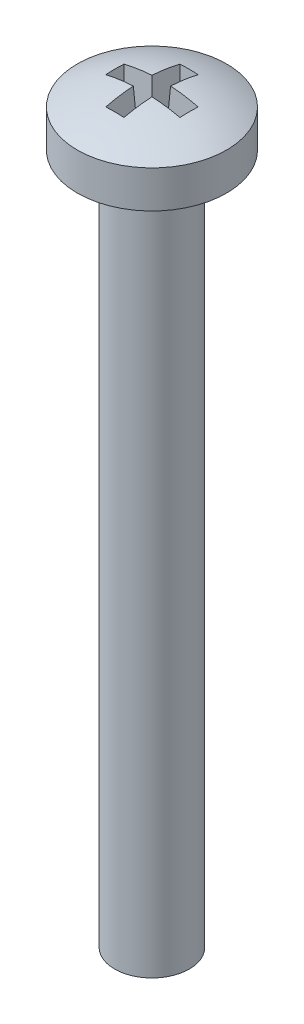
from build123d import *

# Parameters (mm, degrees)
SKETCH1_R           = 2
BOSS_EXTRUDE1_DEPTH = 37
SKETCH2_R           = 4
BOSS_EXTRUDE2_DEPTH = 2
DOME1_FACE_RADIUS   = 4
DOME1_HEIGHT        = 1
CUT_EXTRUDE1_DEPTH  = 3
CUT_EXTRUDE1_TAPER  = 3


with BuildPart() as part:
    # Sketch1 → Boss-Extrude1 (new body)
    with BuildSketch(Plane(origin=(0, 0, 0), x_dir=(1, 0, 0), z_dir=(0, 1, 0))):
        with Locations(Location((0, 0, 0), (0, 0, 270))):
            Circle(SKETCH1_R)
    extrude(amount=BOSS_EXTRUDE1_DEPTH)

    # Sketch2 → Boss-Extrude2 (add)
    with BuildSketch(Plane(origin=(0, 37, 0), x_dir=(1, 0, 0), z_dir=(0, 1, 0))):
        with Locations(Location((0, 0, 0), (0, 0, 270))):
            Circle(SKETCH2_R)
    extrude(amount=BOSS_EXTRUDE2_DEPTH)

    # Dome1: a dome of height H over a round flat face of radius A is a cap of a sphere of radius (A * A + H * H) / (2 * H)
    dome1_r = (DOME1_FACE_RADIUS * DOME1_FACE_RADIUS + DOME1_HEIGHT * DOME1_HEIGHT) / (2 * DOME1_HEIGHT)
    dome1_base = Plane((0, 39, 0), z_dir=(0, 1, 0))
    with Locations(dome1_base.offset(DOME1_HEIGHT - dome1_r)):
        dome1_ball = Sphere(dome1_r, mode=Mode.PRIVATE)
    add(split(dome1_ball, bisect_by=dome1_base, keep=Keep.TOP, mode=Mode.PRIVATE))

    # Sketch4 → Cut-Extrude1 (cut)
    with BuildSketch(Plane(origin=(0, 40, 0), x_dir=(-1, 0, 0), z_dir=(0, -1, 0))):
        Polygon((-0.5, 0.5), (-2, 0.5), (-2, -0.5), (-0.5, -0.5), (-0.5, -2), (0.5, -2), (0.5, -0.5), (2, -0.5), (2, 0.5), (0.5, 0.5), (0.5, 2), (-0.5, 2), align=None)
    extrude(amount=CUT_EXTRUDE1_DEPTH, taper=CUT_EXTRUDE1_TAPER, mode=Mode.SUBTRACT)


solid = part.part
